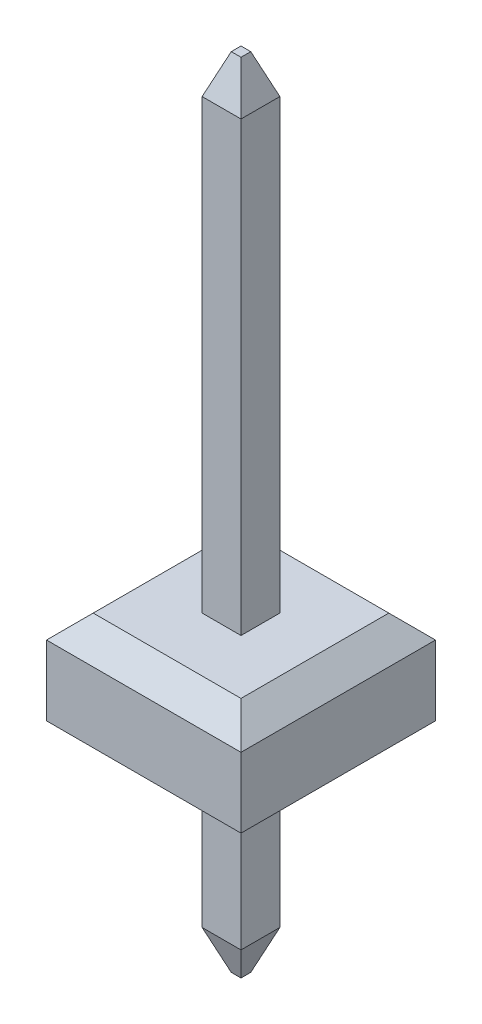
from build123d import *
from OCP.BRepFilletAPI import BRepFilletAPI_MakeChamfer

# Parameters (mm, degrees)
SKETCH1_W           = 2.54
SKETCH1_H           = 2.54
BOSS_EXTRUDE1_DEPTH = 1.524
SKETCH2_W           = 0.508
SKETCH2_H           = 0.508
BOSS_EXTRUDE2_DEPTH = 6.35
SKETCH3_W           = 0.508
SKETCH3_H           = 0.508
BOSS_EXTRUDE3_DEPTH = 2.54
CHAMFER1_SIZE       = 0.508
CHAMFER1_SIZE2      = 0.1905
CHAMFER2_SIZE       = 0.508
CHAMFER2_SIZE2      = 0.1905
CHAMFER4_SIZE       = 0.3048
CHAMFER5_SIZE       = 0.3048


with BuildPart() as part:
    # Sketch1 → Boss-Extrude1 (new body)
    with BuildSketch(Plane(origin=(0, 0, 0), x_dir=(1, 0, 0), z_dir=(0, 1, 0))):
        with Locations((1.27, 1.27)):
            Rectangle(SKETCH1_W, SKETCH1_H)
    extrude(amount=BOSS_EXTRUDE1_DEPTH)

    # Sketch2 → Boss-Extrude2 (add)
    with BuildSketch(Plane(origin=(0, 1.524, 0), x_dir=(1, 0, 0), z_dir=(0, 1, 0))):
        with Locations((1.27, 1.27)):
            Rectangle(SKETCH2_W, SKETCH2_H)
    extrude(amount=BOSS_EXTRUDE2_DEPTH)

    # Sketch3 → Boss-Extrude3 (add)
    with BuildSketch(Plane.XZ):
        with Locations((1.27, -1.27)):
            Rectangle(SKETCH3_W, SKETCH3_H)
    extrude(amount=BOSS_EXTRUDE3_DEPTH)

    # Chamfer1: one chamfer whose edges measure the first distance from different faces: ONE call of the kernel's chamfer builder (chamfer() names one face for all edges)
    chamfer1_edges_1 = [part.edges().sort_by_distance(p)[0] for p in [
        (1.016, 7.874, -1.27),
    ]]
    chamfer1_side_1 = [part.faces().sort_by_distance(p)[0] for p in [
        (1.016, 4.699, -1.27),
    ]]
    chamfer1_edges_2 = [part.edges().sort_by_distance(p)[0] for p in [
        (1.27, 7.874, -1.016),
    ]]
    chamfer1_side_2 = [part.faces().sort_by_distance(p)[0] for p in [
        (1.27, 4.699, -1.016),
    ]]
    chamfer1_edges_3 = [part.edges().sort_by_distance(p)[0] for p in [
        (1.524, 7.874, -1.27),
    ]]
    chamfer1_side_3 = [part.faces().sort_by_distance(p)[0] for p in [
        (1.524, 4.699, -1.27),
    ]]
    chamfer1_edges_4 = [part.edges().sort_by_distance(p)[0] for p in [
        (1.27, 7.874, -1.524),
    ]]
    chamfer1_side_4 = [part.faces().sort_by_distance(p)[0] for p in [
        (1.27, 4.699, -1.524),
    ]]
    chamfer1 = BRepFilletAPI_MakeChamfer(part.part.solid().wrapped)
    for e in chamfer1_edges_1:
        chamfer1.Add(CHAMFER1_SIZE, CHAMFER1_SIZE2, e.wrapped, chamfer1_side_1[0].wrapped)  # the first distance lies on this face
    for e in chamfer1_edges_2:
        chamfer1.Add(CHAMFER1_SIZE, CHAMFER1_SIZE2, e.wrapped, chamfer1_side_2[0].wrapped)  # the first distance lies on this face
    for e in chamfer1_edges_3:
        chamfer1.Add(CHAMFER1_SIZE, CHAMFER1_SIZE2, e.wrapped, chamfer1_side_3[0].wrapped)  # the first distance lies on this face
    for e in chamfer1_edges_4:
        chamfer1.Add(CHAMFER1_SIZE, CHAMFER1_SIZE2, e.wrapped, chamfer1_side_4[0].wrapped)  # the first distance lies on this face
    add(Compound.cast(chamfer1.Shape()), mode=Mode.REPLACE)

    # Chamfer2: one chamfer whose edges measure the first distance from different faces: ONE call of the kernel's chamfer builder (chamfer() names one face for all edges)
    chamfer2_edges_1 = [part.edges().sort_by_distance(p)[0] for p in [
        (1.27, -2.54, -1.524),
    ]]
    chamfer2_side_1 = [part.faces().sort_by_distance(p)[0] for p in [
        (1.27, -1.27, -1.524),
    ]]
    chamfer2_edges_2 = [part.edges().sort_by_distance(p)[0] for p in [
        (1.524, -2.54, -1.27),
    ]]
    chamfer2_side_2 = [part.faces().sort_by_distance(p)[0] for p in [
        (1.524, -1.27, -1.27),
    ]]
    chamfer2_edges_3 = [part.edges().sort_by_distance(p)[0] for p in [
        (1.27, -2.54, -1.016),
    ]]
    chamfer2_side_3 = [part.faces().sort_by_distance(p)[0] for p in [
        (1.27, -1.27, -1.016),
    ]]
    chamfer2_edges_4 = [part.edges().sort_by_distance(p)[0] for p in [
        (1.016, -2.54, -1.27),
    ]]
    chamfer2_side_4 = [part.faces().sort_by_distance(p)[0] for p in [
        (1.016, -1.27, -1.27),
    ]]
    chamfer2 = BRepFilletAPI_MakeChamfer(part.part.solid().wrapped)
    for e in chamfer2_edges_1:
        chamfer2.Add(CHAMFER2_SIZE, CHAMFER2_SIZE2, e.wrapped, chamfer2_side_1[0].wrapped)  # the first distance lies on this face
    for e in chamfer2_edges_2:
        chamfer2.Add(CHAMFER2_SIZE, CHAMFER2_SIZE2, e.wrapped, chamfer2_side_2[0].wrapped)  # the first distance lies on this face
    for e in chamfer2_edges_3:
        chamfer2.Add(CHAMFER2_SIZE, CHAMFER2_SIZE2, e.wrapped, chamfer2_side_3[0].wrapped)  # the first distance lies on this face
    for e in chamfer2_edges_4:
        chamfer2.Add(CHAMFER2_SIZE, CHAMFER2_SIZE2, e.wrapped, chamfer2_side_4[0].wrapped)  # the first distance lies on this face
    add(Compound.cast(chamfer2.Shape()), mode=Mode.REPLACE)

    # Chamfer4
    chamfer4_edges = [part.edges().sort_by_distance(p)[0] for p in [
        (2.54, 1.524, -1.27),
        (1.27, 1.524, -2.54),
        (0, 1.524, -1.27),
        (1.27, 1.524, 0),
    ]]
    chamfer(chamfer4_edges, length=CHAMFER4_SIZE)

    # Chamfer5
    chamfer5_edges = [part.edges().sort_by_distance(p)[0] for p in [
        (1.27, 0, -2.54),
        (2.54, 0, -1.27),
        (1.27, 0, 0),
        (0, 0, -1.27),
    ]]
    chamfer(chamfer5_edges, length=CHAMFER5_SIZE)


solid = part.part
